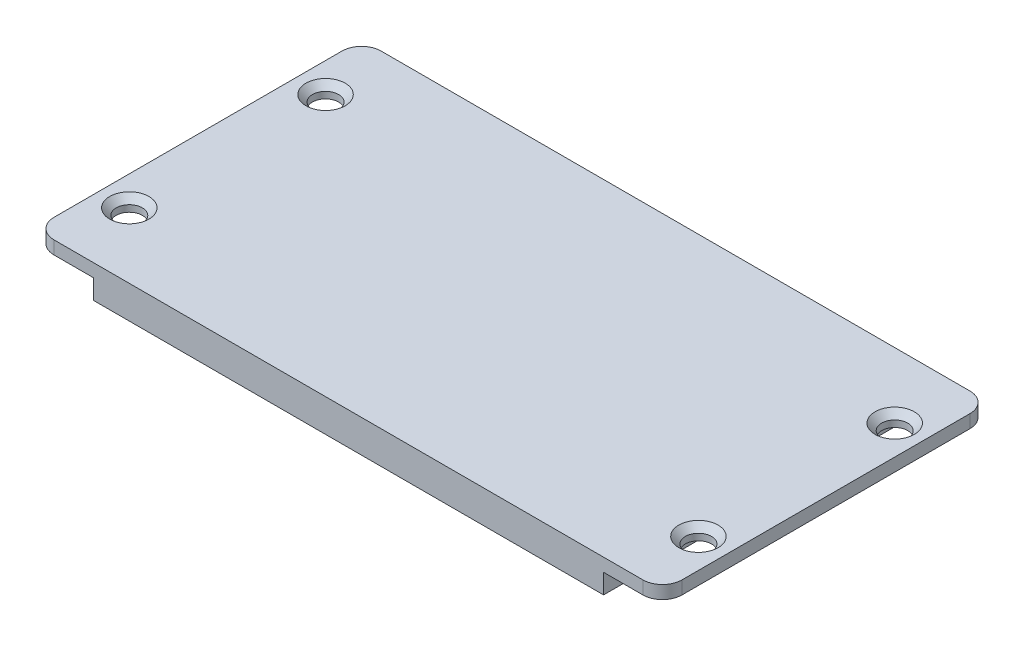
from build123d import *

# Parameters (mm, degrees)
ESQUISSE1_R             = 2
BOSS_EXTRU_1_DEPTH      = 5
CHANFREIN1_SIZE         = 1
ESQUISSE2_W             = 9
ESQUISSE2_H             = 50
ENL_V_MAT_EXTRU_1_DEPTH = 3


with BuildPart() as part:
    # Esquisse1 → Boss.-Extru.1 (new body)
    with BuildSketch(Plane(origin=(0, 0, 0), x_dir=(1, 0, 0), z_dir=(0, 1, 0))):
        with BuildLine():
            Line((-45, 25), (45, 25))
            ThreePointArc((45, 25), (47.121320344, 24.121320344), (48, 22))
            Line((48, 22), (48, -22))
            ThreePointArc((48, -22), (47.121320344, -24.121320344), (45, -25))
            Line((45, -25), (-45, -25))
            ThreePointArc((-45, -25), (-47.121320344, -24.121320344), (-48, -22))
            Line((-48, -22), (-48, 22))
            ThreePointArc((-48, 22), (-47.121320344, 24.121320344), (-45, 25))
        make_face()
        with Locations(Location((-43.5, 15, 0), (0, 0, 270))):
            Circle(ESQUISSE1_R, mode=Mode.SUBTRACT)
        with Locations(Location((43.5, 15, 0), (0, 0, 270))):
            Circle(ESQUISSE1_R, mode=Mode.SUBTRACT)
        with Locations(Location((43.5, -15, 0), (0, 0, 270))):
            Circle(ESQUISSE1_R, mode=Mode.SUBTRACT)
        with Locations(Location((-43.5, -15, 0), (0, 0, 270))):
            Circle(ESQUISSE1_R, mode=Mode.SUBTRACT)
    extrude(amount=-BOSS_EXTRU_1_DEPTH)

    # Chanfrein1
    chanfrein1_edges = [part.edges().sort_by_distance(p)[0] for p in [
        (-43.5, 0, -17),
        (43.5, 0, -17),
        (43.5, 0, 13),
        (-43.5, 0, 13),
    ]]
    chamfer(chanfrein1_edges, length=CHANFREIN1_SIZE)

    # Esquisse2 → Enlèv. mat.-Extru.1 (cut)
    with BuildSketch(Plane(origin=(0, -5, 0), x_dir=(-1, 0, 0), z_dir=(0, -1, 0))):
        with Locations((43.5, 0)):
            Rectangle(ESQUISSE2_W, ESQUISSE2_H)
        with Locations((-43.5, 0)):
            Rectangle(ESQUISSE2_W, ESQUISSE2_H)
    extrude(amount=-ENL_V_MAT_EXTRU_1_DEPTH, mode=Mode.SUBTRACT)


solid = part.part
